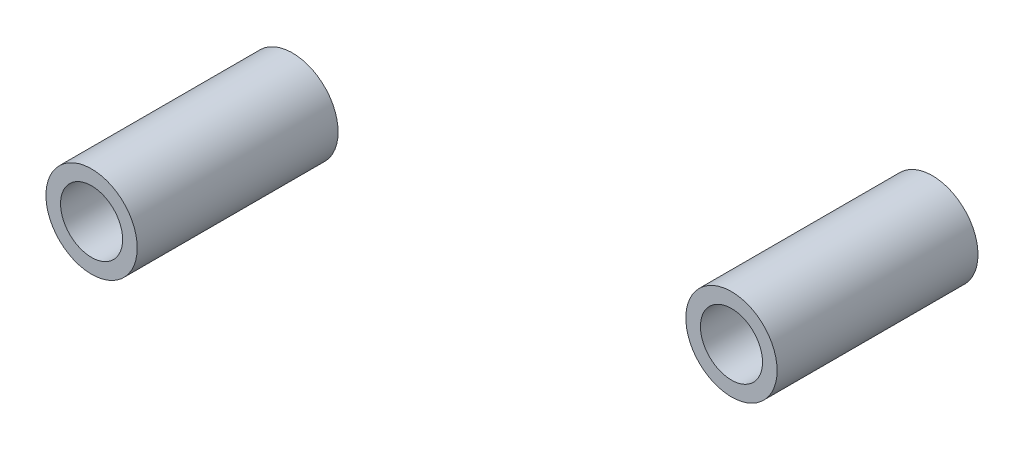
from build123d import *

# Parameters (mm, degrees)
SKETCH1_R           = 2.5
SKETCH1_R_2         = 1.7
BOSS_EXTRUDE1_DEPTH = 11
SKETCH2_R           = 2.5
SKETCH2_R_2         = 1.7
BOSS_EXTRUDE2_DEPTH = 11


with BuildPart() as part:
    # Sketch1 → Boss-Extrude1 (new body)
    with BuildSketch(Plane.XY.offset(347.5)):
        with Locations((315.090923202, 53.124939501)):
            Circle(SKETCH1_R)
        with Locations((315.090923202, 53.124939501)):
            Circle(SKETCH1_R_2, mode=Mode.SUBTRACT)
    extrude(amount=BOSS_EXTRUDE1_DEPTH)


with BuildPart() as body_2:
    # Sketch2 → Boss-Extrude2 (new body)
    with BuildSketch(Plane.XY.offset(347.5)):
        with Locations((280.050647312, 41.422437104)):
            Circle(SKETCH2_R)
        with Locations((280.050647312, 41.422437104)):
            Circle(SKETCH2_R_2, mode=Mode.SUBTRACT)
    extrude(amount=BOSS_EXTRUDE2_DEPTH)


solid = Compound([part.part, body_2.part])
